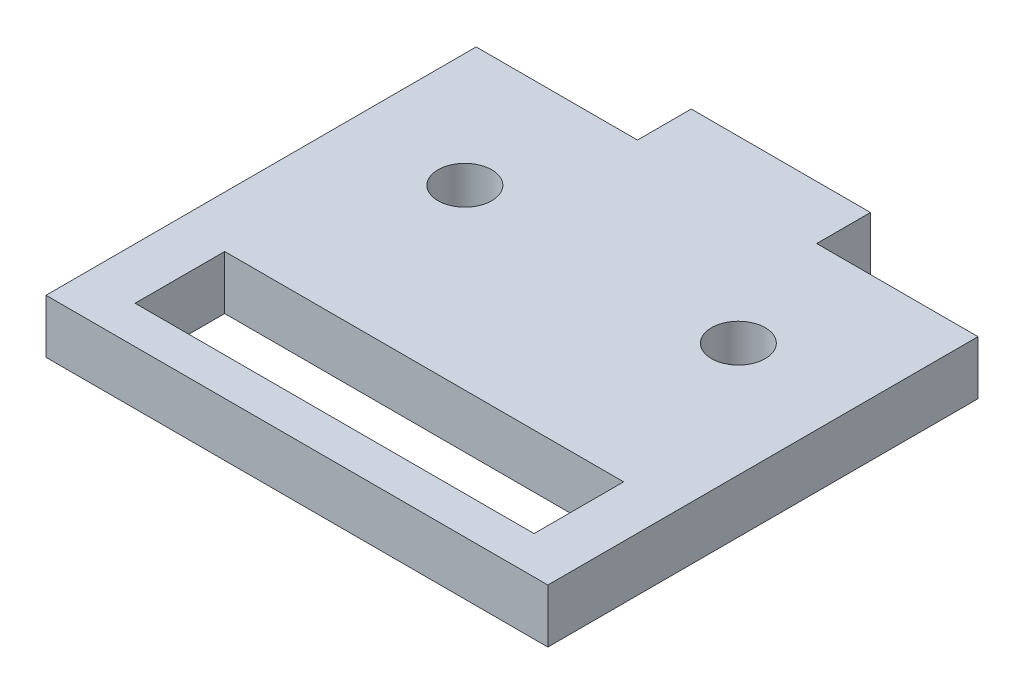
from build123d import *

# Parameters (mm, degrees)
SKETCH1_R           = 1.5
SKETCH1_W           = 22.26
SKETCH1_H           = 5
BOSS_EXTRUDE1_DEPTH = 3


with BuildPart() as part:
    # Sketch1 → Boss-Extrude1 (new body)
    with BuildSketch(Plane(origin=(0, 0, 0), x_dir=(1, 0, 0), z_dir=(0, 1, 0))):
        Polygon((-5, 3), (5, 3), (14, 3), (14, 27), (5, 27), (5, 30), (-5, 30), (-5, 27), (-14, 27), (-14, 3), align=None)
        with Locations(Location((7.63, 20, 0), (0, 0, 270))):
            Circle(SKETCH1_R, mode=Mode.SUBTRACT)
        with Locations(Location((-7.63, 20, 0), (0, 0, 90))):
            Circle(SKETCH1_R, mode=Mode.SUBTRACT)
        with Locations((0, 7.6)):
            Rectangle(SKETCH1_W, SKETCH1_H, mode=Mode.SUBTRACT)
    extrude(amount=BOSS_EXTRUDE1_DEPTH)


solid = part.part
